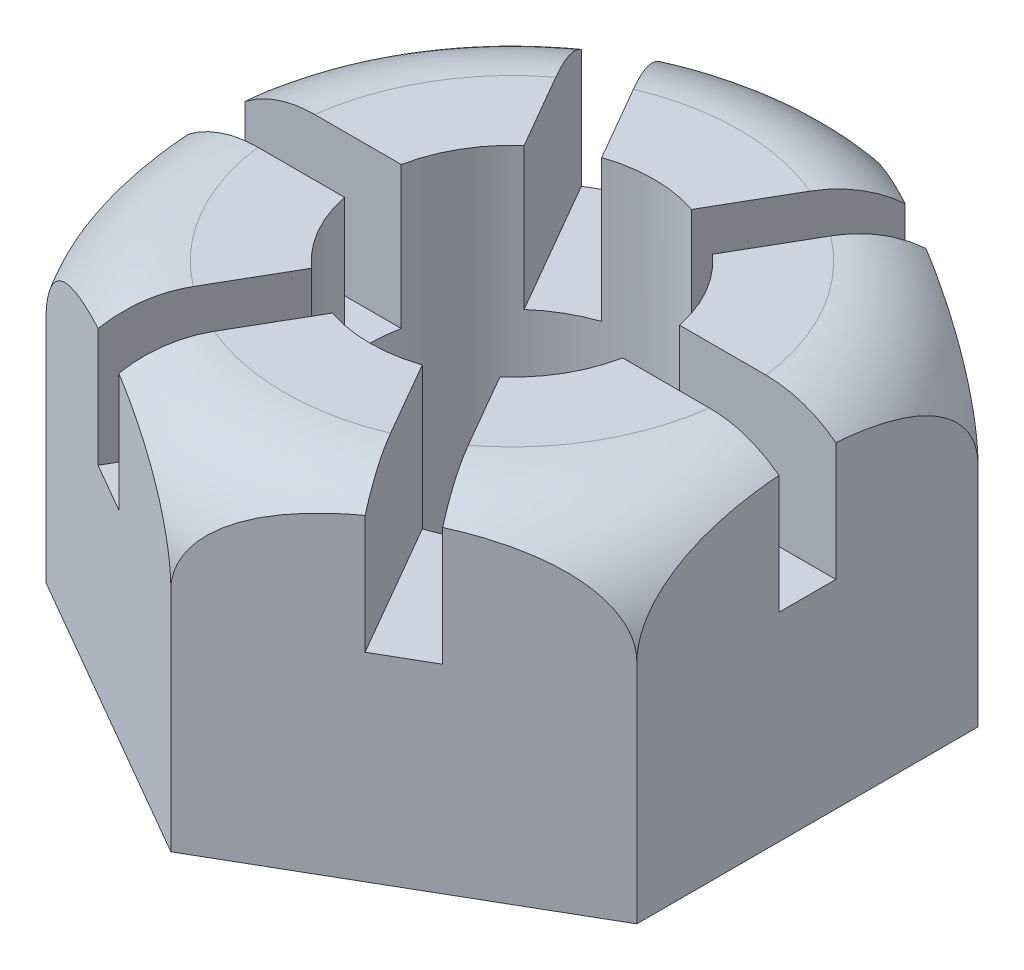
from build123d import *

# Parameters (mm, degrees)
BOSS_EXTRUDE1_DEPTH = 15.24
CUT_EXTRUDE2_DEPTH  = 6.35
SKETCH8_R           = 6.35
CUT_EXTRUDE4_DEPTH  = 26.284591317


with BuildPart() as part:
    # Sketch1 → Boss-Extrude1 (new body)
    with BuildSketch(Plane(origin=(0, 0, 0), x_dir=(1, 0, 0), z_dir=(0, 1, 0))):
        Polygon((0, 15.251284711), (-13.208, 7.625642355), (-13.208, -7.625642355), (0, -15.251284711), (13.208, -7.625642355), (13.208, 7.625642355), align=None)
    extrude(amount=BOSS_EXTRUDE1_DEPTH)

    # Sketch2 → Cut-Revolve2 (revolve, cut)
    with BuildSketch(Plane(origin=(0, 0, 0), x_dir=(0, 0, -1), z_dir=(1, 0, 0))):
        with BuildLine():
            Line((15.251284711, 10.16), (15.251284711, 0))
            Line((15.251284711, 0), (20.607145121, 0))
            Line((20.607145121, 0), (20.607145121, 19.004731249))
            Line((20.607145121, 19.004731249), (7.625642355, 19.004731249))
            Line((7.625642355, 19.004731249), (7.625642355, 15.24))
            Line((7.625642355, 15.24), (10.171284711, 15.24))
            ThreePointArc((10.171284711, 15.24), (13.763387159, 13.752102448), (15.251284711, 10.16))
        make_face()
    revolve(axis=Axis((0, 0, 0), (0, 1, 0)), mode=Mode.SUBTRACT)

    # Sketch4 → Cut-Extrude2 (cut)
    with BuildSketch(Plane(origin=(0, 15.24, 0), x_dir=(1, 0, 0), z_dir=(0, 1, 0))):
        Polygon((-7.703852263, 10.803463533), (-2.199704526, 1.27), (-13.208, 1.27), (-13.208, -1.27), (-2.199704526, -1.27), (-7.703852263, -10.803463533), (-5.504147737, -12.073463533), (0, -2.54), (5.504147737, -12.073463533), (7.703852263, -10.803463533), (2.199704526, -1.27), (13.208, -1.27), (13.208, 1.27), (2.199704526, 1.27), (7.703852263, 10.803463533), (5.504147737, 12.073463533), (0, 2.54), (-5.504147737, 12.073463533), align=None)
    extrude(amount=-CUT_EXTRUDE2_DEPTH, mode=Mode.SUBTRACT)

    # Sketch8 → Cut-Extrude4 (cut, through all)
    with BuildSketch(Plane(origin=(0, 15.24, 0), x_dir=(1, 0, 0), z_dir=(0, 1, 0))):
        with Locations(Location((0, 0, 0), (0, 0, 270))):
            Circle(SKETCH8_R)
    extrude(amount=-CUT_EXTRUDE4_DEPTH, mode=Mode.SUBTRACT)


solid = part.part
